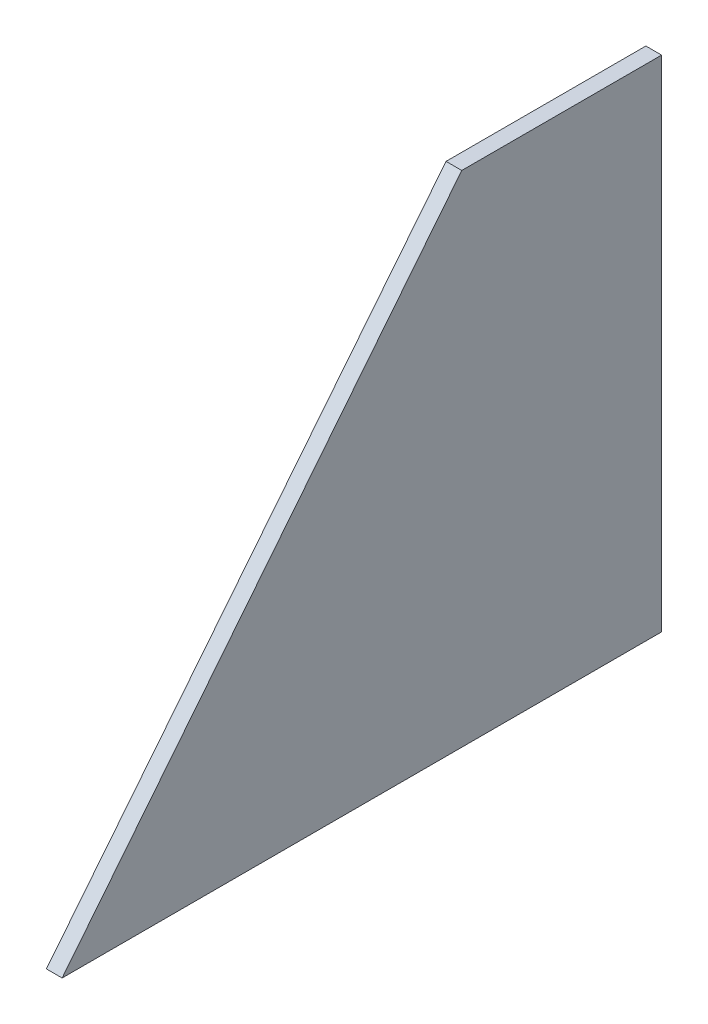
from build123d import *

# Parameters (mm, degrees)
SKETCH1_W           = 76.2
SKETCH1_H           = 190.5
BOSS_EXTRUDE1_DEPTH = 6


with BuildPart() as part:
    # Sketch1 → Boss-Extrude1 (new body)
    with BuildSketch(Plane(origin=(0, 0, 0), x_dir=(0, 0, -1), z_dir=(1, 0, 0))):
        Polygon((-190.5, -95.25), (-38.1, 95.25), (-38.1, -95.25), align=None)
        Rectangle(SKETCH1_W, SKETCH1_H)
    extrude(amount=BOSS_EXTRUDE1_DEPTH)


solid = part.part
